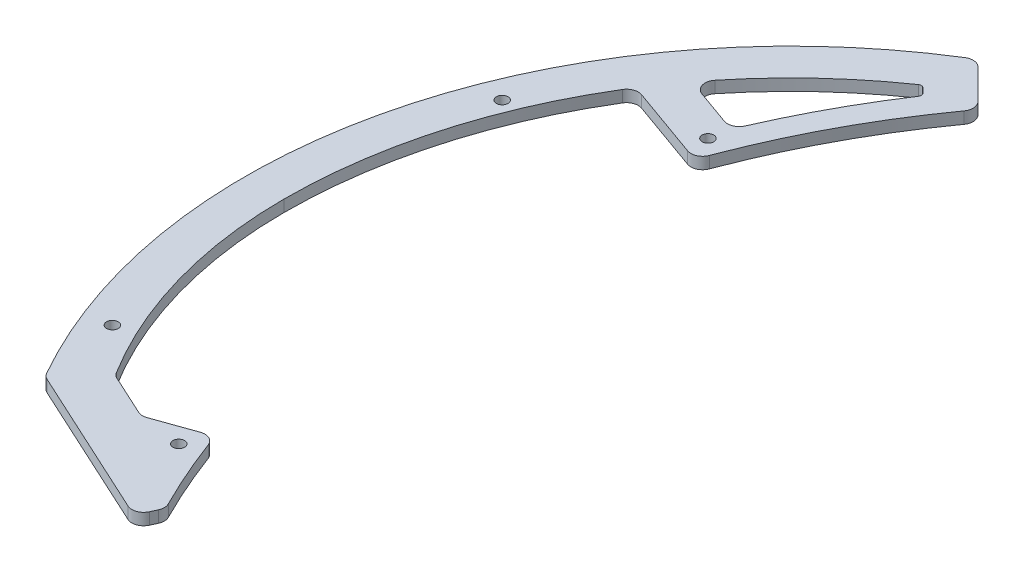
from build123d import *

# Parameters (mm, degrees)
SKETCH1_R           = 140
BOSS_EXTRUDE1_DEPTH = 3
CUT_EXTRUDE3_REACH  = 200.013
SKETCH19_R          = 1.5
CUT_EXTRUDE10_REACH = 200.013
SKETCH25_R          = 1.5
CUT_EXTRUDE4_REACH  = 200.013
FILLET2_R           = 10
SKETCH26_R          = 1.5
CUT_EXTRUDE11_DEPTH = 3
FILLET6_R           = 3
FILLET7_R           = 1


with BuildPart() as part:
    # Sketch1 → Boss-Extrude1 (new body)
    with BuildSketch(Plane(origin=(0, 0, 0), x_dir=(1, 0, 0), z_dir=(0, 1, 0))):
        with Locations(Location((0, 0, 0), (0, 0, 270))):
            Circle(SKETCH1_R)
    extrude(amount=BOSS_EXTRUDE1_DEPTH)

    # Sketch19 → Cut-Extrude3 (cut, up to next)
    with BuildSketch(Plane(origin=(0, 3, 0), x_dir=(1, 0, 0), z_dir=(0, 1, 0)), mode=Mode.PRIVATE) as cut_extrude3_sk1:
        with Locations(Location((-89.09545443, -67.882250994, 0), (0, 0, 270))):
            Circle(SKETCH19_R)
    cut_extrude3_tool1 = extrude(cut_extrude3_sk1.sketch, amount=-CUT_EXTRUDE3_REACH, mode=Mode.PRIVATE) & part.part
    # Sketch19 → Cut-Extrude3 (cut, up to next)
    with BuildSketch(Plane(origin=(0, 3, 0), x_dir=(1, 0, 0), z_dir=(0, 1, 0)), mode=Mode.PRIVATE) as cut_extrude3_sk2:
        with Locations(Location((-89.09545443, 67.882250994, 0), (0, 0, 270))):
            Circle(SKETCH19_R)
    cut_extrude3_tool2 = extrude(cut_extrude3_sk2.sketch, amount=-CUT_EXTRUDE3_REACH, mode=Mode.PRIVATE) & part.part
    # Sketch19 → Cut-Extrude3 (cut, up to next)
    with BuildSketch(Plane(origin=(0, 3, 0), x_dir=(1, 0, 0), z_dir=(0, 1, 0)), mode=Mode.PRIVATE) as cut_extrude3_sk3:
        with Locations(Location((89.09545443, 67.882250994, 0), (0, 0, 270))):
            Circle(SKETCH19_R)
    cut_extrude3_tool3 = extrude(cut_extrude3_sk3.sketch, amount=-CUT_EXTRUDE3_REACH, mode=Mode.PRIVATE) & part.part
    # Sketch19 → Cut-Extrude3 (cut, up to next)
    with BuildSketch(Plane(origin=(0, 3, 0), x_dir=(1, 0, 0), z_dir=(0, 1, 0)), mode=Mode.PRIVATE) as cut_extrude3_sk4:
        with Locations(Location((89.09545443, -67.882250994, 0), (0, 0, 270))):
            Circle(SKETCH19_R)
    cut_extrude3_tool4 = extrude(cut_extrude3_sk4.sketch, amount=-CUT_EXTRUDE3_REACH, mode=Mode.PRIVATE) & part.part
    # Sketch19 → Cut-Extrude3 (cut, up to next)
    with BuildSketch(Plane(origin=(0, 3, 0), x_dir=(1, 0, 0), z_dir=(0, 1, 0)), mode=Mode.PRIVATE) as cut_extrude3_sk5:
        with Locations(Location((-67.882250994, 89.09545443, 0), (0, 0, 270))):
            Circle(SKETCH19_R)
    cut_extrude3_tool5 = extrude(cut_extrude3_sk5.sketch, amount=-CUT_EXTRUDE3_REACH, mode=Mode.PRIVATE) & part.part
    # Sketch19 → Cut-Extrude3 (cut, up to next)
    with BuildSketch(Plane(origin=(0, 3, 0), x_dir=(1, 0, 0), z_dir=(0, 1, 0)), mode=Mode.PRIVATE) as cut_extrude3_sk6:
        with Locations(Location((67.882250994, 89.09545443, 0), (0, 0, 270))):
            Circle(SKETCH19_R)
    cut_extrude3_tool6 = extrude(cut_extrude3_sk6.sketch, amount=-CUT_EXTRUDE3_REACH, mode=Mode.PRIVATE) & part.part
    # Sketch19 → Cut-Extrude3 (cut, up to next)
    with BuildSketch(Plane(origin=(0, 3, 0), x_dir=(1, 0, 0), z_dir=(0, 1, 0)), mode=Mode.PRIVATE) as cut_extrude3_sk7:
        with Locations(Location((67.882250994, -89.09545443, 0), (0, 0, 270))):
            Circle(SKETCH19_R)
    cut_extrude3_tool7 = extrude(cut_extrude3_sk7.sketch, amount=-CUT_EXTRUDE3_REACH, mode=Mode.PRIVATE) & part.part
    # Sketch19 → Cut-Extrude3 (cut, up to next)
    with BuildSketch(Plane(origin=(0, 3, 0), x_dir=(1, 0, 0), z_dir=(0, 1, 0)), mode=Mode.PRIVATE) as cut_extrude3_sk8:
        with Locations(Location((-67.882250994, -89.09545443, 0), (0, 0, 270))):
            Circle(SKETCH19_R)
    cut_extrude3_tool8 = extrude(cut_extrude3_sk8.sketch, amount=-CUT_EXTRUDE3_REACH, mode=Mode.PRIVATE) & part.part
    add(cut_extrude3_tool1.solids().sort_by_distance((-89.095454, 3, 67.882251))[0], mode=Mode.SUBTRACT)
    add(cut_extrude3_tool2.solids().sort_by_distance((-89.095454, 3, -67.882251))[0], mode=Mode.SUBTRACT)
    add(cut_extrude3_tool3.solids().sort_by_distance((89.095454, 3, -67.882251))[0], mode=Mode.SUBTRACT)
    add(cut_extrude3_tool4.solids().sort_by_distance((89.095454, 3, 67.882251))[0], mode=Mode.SUBTRACT)
    add(cut_extrude3_tool5.solids().sort_by_distance((-67.882251, 3, -89.095454))[0], mode=Mode.SUBTRACT)
    add(cut_extrude3_tool6.solids().sort_by_distance((67.882251, 3, -89.095454))[0], mode=Mode.SUBTRACT)
    add(cut_extrude3_tool7.solids().sort_by_distance((67.882251, 3, 89.095454))[0], mode=Mode.SUBTRACT)
    add(cut_extrude3_tool8.solids().sort_by_distance((-67.882251, 3, 89.095454))[0], mode=Mode.SUBTRACT)

    # Sketch25 → Cut-Extrude10 (cut, up to next)
    with BuildSketch(Plane(origin=(0, 3, 0), x_dir=(1, 0, 0), z_dir=(0, 1, 0)), mode=Mode.PRIVATE) as cut_extrude10_sk1:
        with Locations(Location((-124, 50, 0), (0, 0, 270))):
            Circle(SKETCH25_R)
    cut_extrude10_tool1 = extrude(cut_extrude10_sk1.sketch, amount=-CUT_EXTRUDE10_REACH, mode=Mode.PRIVATE) & part.part
    # Sketch25 → Cut-Extrude10 (cut, up to next)
    with BuildSketch(Plane(origin=(0, 3, 0), x_dir=(1, 0, 0), z_dir=(0, 1, 0)), mode=Mode.PRIVATE) as cut_extrude10_sk2:
        with Locations(Location((-124, -50, 0), (0, 0, 270))):
            Circle(SKETCH25_R)
    cut_extrude10_tool2 = extrude(cut_extrude10_sk2.sketch, amount=-CUT_EXTRUDE10_REACH, mode=Mode.PRIVATE) & part.part
    add(cut_extrude10_tool1.solids().sort_by_distance((-124, 3, -50))[0], mode=Mode.SUBTRACT)
    add(cut_extrude10_tool2.solids().sort_by_distance((-124, 3, 50))[0], mode=Mode.SUBTRACT)

    # Sketch20 → Cut-Extrude4 (cut, up to next)
    with BuildSketch(Plane(origin=(0, 3, 0), x_dir=(1, 0, 0), z_dir=(0, 1, 0)), mode=Mode.PRIVATE) as cut_extrude4_sk1:
        Polygon((-553.578520829, 601.645168987), (-72, 120.066648158), (-50, 98.066648158), (50, 98.066648158), (72, 120.066648158), (553.578520829, 601.645168987), (553.578520829, 1963.754919995), (-553.578520829, 1963.754919995), align=None)
    cut_extrude4_tool1 = extrude(cut_extrude4_sk1.sketch, amount=-CUT_EXTRUDE4_REACH, mode=Mode.PRIVATE) & part.part
    add(cut_extrude4_tool1.solids().sort_by_distance((0, 3, -1137.970098))[0], mode=Mode.SUBTRACT)

    # Fillet2
    fillet2_edges = [part.edges().sort_by_distance(p)[0] for p in [
        (50, 1.5, -98.066648158),
        (-50, 1.5, -98.066648158),
    ]]
    fillet(fillet2_edges, radius=FILLET2_R)

    # Sketch26 → Cut-Extrude11 (cut)
    # profile 1 of 7: a face of its own
    with BuildSketch(Plane(origin=(0, 3, 0), x_dir=(1, 0, 0), z_dir=(0, 1, 0))):
        with BuildLine():
            Line((-79.056988797, -89.449340058), (-121.24355653, -70))
            ThreePointArc((-121.24355653, -70), (98.171098855, -99.812000028), (72, 120.066648158))
            Line((72, 120.066648158), (52.928932188, 100.995580347))
            ThreePointArc((52.928932188, 100.995580347), (49.6846987, 98.827852833), (45.857864376, 98.066648158))
            Line((45.857864376, 98.066648158), (-45.857864376, 98.066648158))
            ThreePointArc((-45.857864376, 98.066648158), (-49.6846987, 98.827852833), (-52.928932188, 100.995580347))
            Line((-52.928932188, 100.995580347), (-60.850013122, 108.91666128))
            ThreePointArc((-60.850013122, 108.91666128), (-75.23752201, 86.148205434), (-86.128818141, 61.515246573))
            Line((-86.128818141, 61.515246573), (-109.612709786, 69.893160276))
            ThreePointArc((-109.612709786, 69.893160276), (-124.799143171, 36.402937572), (-130, 0))
            ThreePointArc((-130, 0), (-125.518409602, -31.669231283), (-112.425579752, -60.851463362))
            Line((-112.425579752, -60.851463362), (-100.142136058, -66.514518839))
            Line((-100.142136058, -66.514518839), (-86.128818141, -61.515246573))
            ThreePointArc((-86.128818141, -61.515246573), (-81.664833416, -72.826250762), (-76.459826151, -83.815967535))
            Line((-76.459826151, -83.815967535), (-79.056988797, -89.449340058))
        make_face()
        with Locations((-67.882250994, -89.09545443)):
            Circle(SKETCH26_R, mode=Mode.SUBTRACT)
        with Locations((67.882250994, -89.09545443)):
            Circle(SKETCH26_R, mode=Mode.SUBTRACT)
        with Locations((89.09545443, -67.882250994)):
            Circle(SKETCH26_R, mode=Mode.SUBTRACT)
        with Locations((-67.882250994, 89.09545443)):
            Circle(SKETCH26_R, mode=Mode.SUBTRACT)
        with Locations((67.882250994, 89.09545443)):
            Circle(SKETCH26_R, mode=Mode.SUBTRACT)
        with Locations((89.09545443, 67.882250994)):
            Circle(SKETCH26_R, mode=Mode.SUBTRACT)
    # profile 2 of 7: a face of its own
    with BuildSketch(Plane(origin=(0, 3, 0), x_dir=(1, 0, 0), z_dir=(0, 1, 0))):
        with BuildLine():
            Line((-103.69839741, 78.400525346), (-88.170631715, 72.860971556))
            ThreePointArc((-88.170631715, 72.860971556), (-80.354415694, 89.303260425), (-70.993089828, 104.917602363))
            Line((-70.993089828, 104.917602363), (-73.383091495, 107.30760403))
            ThreePointArc((-73.383091495, 107.30760403), (-89.712698252, 94.083110983), (-103.69839741, 78.400525346))
        make_face()
    # profile 3 of 7: a face of its own
    with BuildSketch(Plane(origin=(0, 3, 0), x_dir=(1, 0, 0), z_dir=(0, 1, 0))):
        with Locations((-67.882250994, 89.09545443)):
            Circle(SKETCH26_R)
    # profile 4 of 7: a face of its own
    with BuildSketch(Plane(origin=(0, 3, 0), x_dir=(1, 0, 0), z_dir=(0, 1, 0))):
        with Locations(Location((-89.09545443, 67.882250994, 0), (0, 0, 270))):
            Circle(SKETCH26_R)
    # profile 5 of 7: a face of its own
    with BuildSketch(Plane(origin=(0, 3, 0), x_dir=(1, 0, 0), z_dir=(0, 1, 0))):
        with Locations(Location((-124, 50, 0), (0, 0, 270))):
            Circle(SKETCH26_R)
    # profile 6 of 7: a face of its own
    with BuildSketch(Plane(origin=(0, 3, 0), x_dir=(1, 0, 0), z_dir=(0, 1, 0))):
        with Locations(Location((-89.09545443, -67.882250994, 0), (0, 0, 270))):
            Circle(SKETCH26_R)
    # profile 7 of 7: a face of its own
    with BuildSketch(Plane(origin=(0, 3, 0), x_dir=(1, 0, 0), z_dir=(0, 1, 0))):
        with Locations(Location((-124, -50, 0), (0, 0, 270))):
            Circle(SKETCH26_R)
    extrude(amount=-CUT_EXTRUDE11_DEPTH, mode=Mode.SUBTRACT)

    # Fillet6
    fillet6_edges = [part.edges().sort_by_distance(p)[0] for p in [
        (-109.612709786, 1.5, -69.893160276),
        (-86.128818141, 1.5, -61.515246573),
        (-60.850013122, 1.5, -108.91666128),
        (-121.24355653, 1.5, 70),
        (-79.056988797, 1.5, 89.449340058),
        (-76.459826151, 1.5, 83.815967535),
        (-86.128818141, 1.5, 61.515246573),
        (-100.142136058, 1.5, 66.514518839),
        (-112.425579752, 1.5, 60.851463362),
        (-72, 1.5, -120.066648158),
        (-88.170631715, 1.5, -72.860971556),
        (-103.69839741, 1.5, -78.400525346),
    ]]
    fillet(fillet6_edges, radius=FILLET6_R)

    # Fillet7
    fillet7_edges = [part.edges().sort_by_distance(p)[0] for p in [
        (-73.383091495, 1.5, -107.30760403),
        (-70.993089828, 1.5, -104.917602363),
    ]]
    fillet(fillet7_edges, radius=FILLET7_R)


solid = part.part
